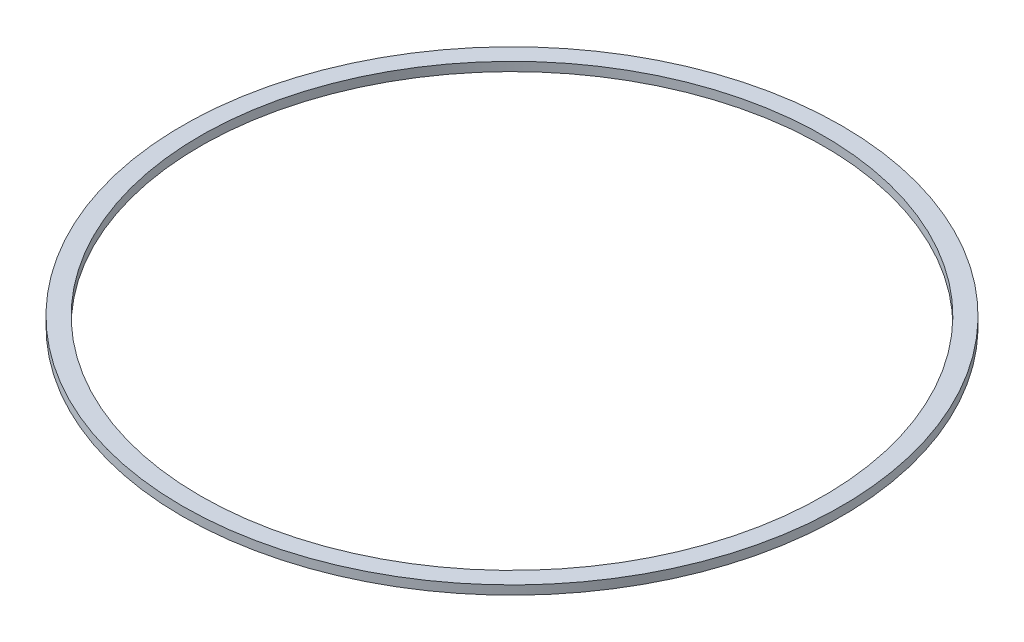
from build123d import *

# Parameters (mm, degrees)
SKETCH1_R           = 37
SKETCH1_R_2         = 35
BOSS_EXTRUDE1_DEPTH = 1


with BuildPart() as part:
    # Sketch1 → Boss-Extrude1 (new body)
    with BuildSketch(Plane(origin=(0, 0, 0), x_dir=(1, 0, 0), z_dir=(0, 1, 0))):
        with Locations(Location((0, 0, 0), (0, 0, 270))):
            Circle(SKETCH1_R)
        with Locations(Location((0, 0, 0), (0, 0, 270))):
            Circle(SKETCH1_R_2, mode=Mode.SUBTRACT)
    extrude(amount=BOSS_EXTRUDE1_DEPTH)


solid = part.part
